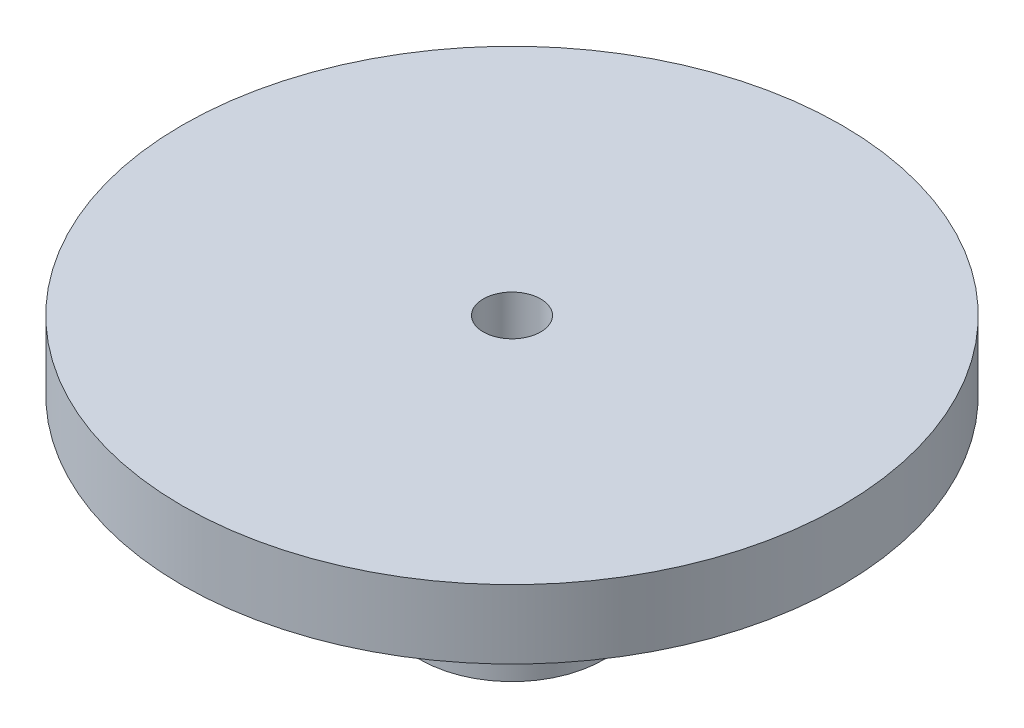
from build123d import *

# Parameters (mm, degrees)
SKETCH1_R           = 8
SKETCH1_R_2         = 2.5
BOSS_EXTRUDE1_DEPTH = 16
SKETCH2_R           = 28.75
SKETCH2_R_2         = 2.5
BOSS_EXTRUDE2_DEPTH = 6


with BuildPart() as part:
    # Sketch1 → Boss-Extrude1 (new body)
    with BuildSketch(Plane(origin=(0, 0, 0), x_dir=(1, 0, 0), z_dir=(0, 1, 0))):
        with Locations(Location((0, 0, 0), (0, 0, 270))):
            Circle(SKETCH1_R)
        with Locations(Location((0, 0, 0), (0, 0, 270))):
            Circle(SKETCH1_R_2, mode=Mode.SUBTRACT)
    extrude(amount=BOSS_EXTRUDE1_DEPTH)

    # Sketch2 → Boss-Extrude2 (add)
    with BuildSketch(Plane(origin=(0, 16, 0), x_dir=(1, 0, 0), z_dir=(0, 1, 0))):
        with Locations(Location((0, 0, 0), (0, 0, 270))):
            Circle(SKETCH2_R)
        with Locations(Location((0, 0, 0), (0, 0, 270))):
            Circle(SKETCH2_R_2, mode=Mode.SUBTRACT)
    extrude(amount=BOSS_EXTRUDE2_DEPTH)


solid = part.part
